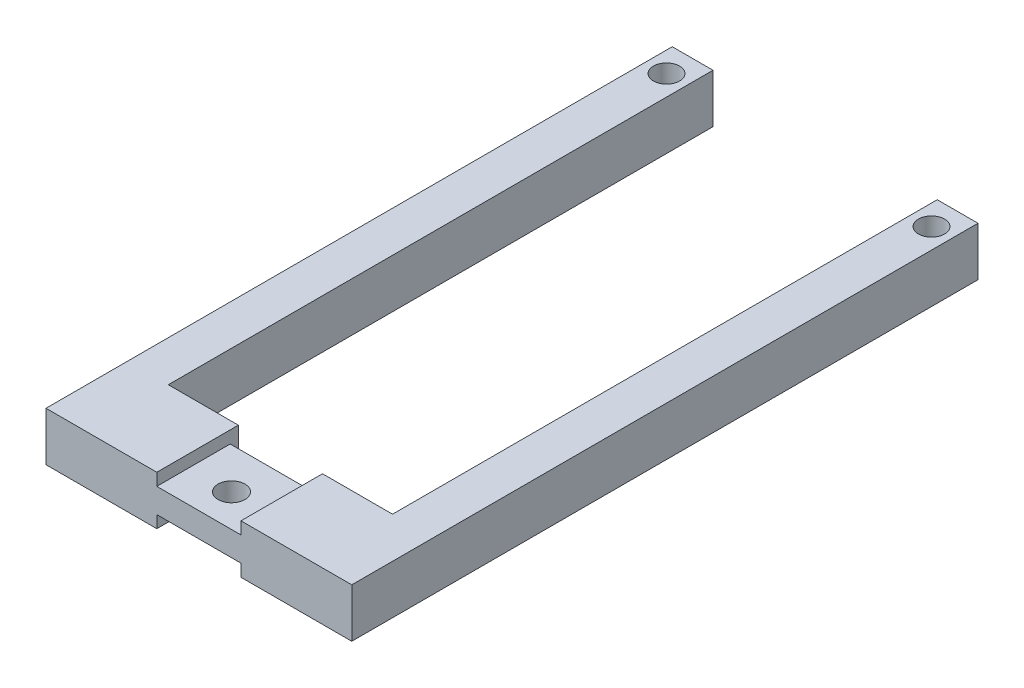
from build123d import *

# Parameters (mm, degrees)
SKETCH1_R           = 1.65
BOSS_EXTRUDE1_DEPTH = 8
SKETCH2_W           = 10.32
SKETCH2_H           = 9
CUT_EXTRUDE1_DEPTH  = 2.4
SKETCH3_W           = 10.32
SKETCH3_H           = 9
CUT_EXTRUDE2_DEPTH  = 2.4
BOSS_EXTRUDE2_DEPTH = 8
SKETCH7_W           = 76.8
SKETCH7_H           = 1
CUT_EXTRUDE3_DEPTH  = 68.43727806
SKETCH9_W           = 10.32
SKETCH9_H           = 0.1
CUT_EXTRUDE4_DEPTH  = 10
SKETCH10_R          = 1.6
SKETCH10_W          = 1.25
SKETCH10_H          = 66.8
SKETCH10_W_2        = 0.75
SKETCH10_H_2        = 76.8
CUT_EXTRUDE5_DEPTH  = 6


with BuildPart() as part:
    # Sketch1 → Boss-Extrude1 (new body)
    with BuildSketch(Plane(origin=(0, 0, 0), x_dir=(1, 0, 0), z_dir=(0, 1, 0))):
        Polygon((-37.890672074, -44.431484199), (-30.550672074, -44.431484199), (-30.550672074, -45.431484199), (-20.230672074, -45.431484199), (-20.230672074, -44.431484199), (-12.890672074, -44.431484199), (-12.890672074, 4.468515801), (-7.890672074, 4.468515801), (-7.890672074, -54.431484199), (-42.890672074, -54.431484199), (-42.890672074, 4.468515801), (-37.890672074, 4.468515801), align=None)
        with Locations(Location((-25.390672074, -50.431484199, 0), (0, 0, 270))):
            Circle(SKETCH1_R, mode=Mode.SUBTRACT)
    extrude(amount=BOSS_EXTRUDE1_DEPTH)

    # Sketch2 → Cut-Extrude1 (cut)
    with BuildSketch(Plane(origin=(0, 8, 0), x_dir=(1, 0, 0), z_dir=(0, 1, 0))):
        with Locations((-25.390672074, -49.931484199)):
            Rectangle(SKETCH2_W, SKETCH2_H)
    extrude(amount=-CUT_EXTRUDE1_DEPTH, mode=Mode.SUBTRACT)

    # Sketch3 → Cut-Extrude2 (cut)
    with BuildSketch(Plane.XZ):
        with Locations((-25.390672074, 49.931484199)):
            Rectangle(SKETCH3_W, SKETCH3_H)
    extrude(amount=-CUT_EXTRUDE2_DEPTH, mode=Mode.SUBTRACT)

    # Sketch6 → Boss-Extrude2 (add)
    with BuildSketch(Plane.XZ):
        Polygon((-37.890672074, -22.368515801), (-37.890672074, -4.468515801), (-42.890672074, -4.468515801), (-42.890672074, 54.431484199), (-44.890672074, 54.431484199), (-44.890672074, -10.768515801), (-44.890672074, -22.368515801), align=None)
        Polygon((-7.890672074, -4.468515801), (-12.890672074, -4.468515801), (-12.890672074, -22.368515801), (-5.890672074, -22.368515801), (-5.890672074, -10.768515801), (-5.890672074, 54.431484199), (-7.890672074, 54.431484199), align=None)
    extrude(amount=-BOSS_EXTRUDE2_DEPTH)

    # Sketch7 → Cut-Extrude3 (cut, through all)
    with BuildSketch(Plane(origin=(-5.890672074, 0, 0), x_dir=(0, 0, -1), z_dir=(1, 0, 0))):
        with Locations((-16.031484199, 7.5)):
            Rectangle(SKETCH7_W, SKETCH7_H)
        with Locations((-16.031484199, 0.5)):
            Rectangle(SKETCH7_W, SKETCH7_H)
    extrude(amount=-CUT_EXTRUDE3_DEPTH, mode=Mode.SUBTRACT)

    # Sketch9 → Cut-Extrude4 (cut)
    with BuildSketch(Plane.XY.offset(54.431484199)):
        with Locations((-25.390672074, 5.55)):
            Rectangle(SKETCH9_W, SKETCH9_H)
        with Locations((-25.390672074, 2.45)):
            Rectangle(SKETCH9_W, SKETCH9_H)
    extrude(amount=-CUT_EXTRUDE4_DEPTH, mode=Mode.SUBTRACT)

    # Sketch10 → Cut-Extrude5 (cut)
    with BuildSketch(Plane(origin=(0, 7, 0), x_dir=(1, 0, 0), z_dir=(0, 1, 0))):
        with Locations(Location((-41.640672074, 19.168515801, 0), (0, 0, 270))):
            Circle(SKETCH10_R)
        with Locations(Location((-9.140672074, 19.168515801, 0), (0, 0, 270))):
            Circle(SKETCH10_R)
        with Locations((-38.515672074, -11.031484199)):
            Rectangle(SKETCH10_W, SKETCH10_H)
        with Locations((-12.265672074, -11.031484199)):
            Rectangle(SKETCH10_W, SKETCH10_H)
        with Locations((-6.265672074, -16.031484199)):
            Rectangle(SKETCH10_W_2, SKETCH10_H_2)
        with Locations((-44.515672074, -16.031484199)):
            Rectangle(SKETCH10_W_2, SKETCH10_H_2)
    extrude(amount=-CUT_EXTRUDE5_DEPTH, mode=Mode.SUBTRACT)


solid = part.part
